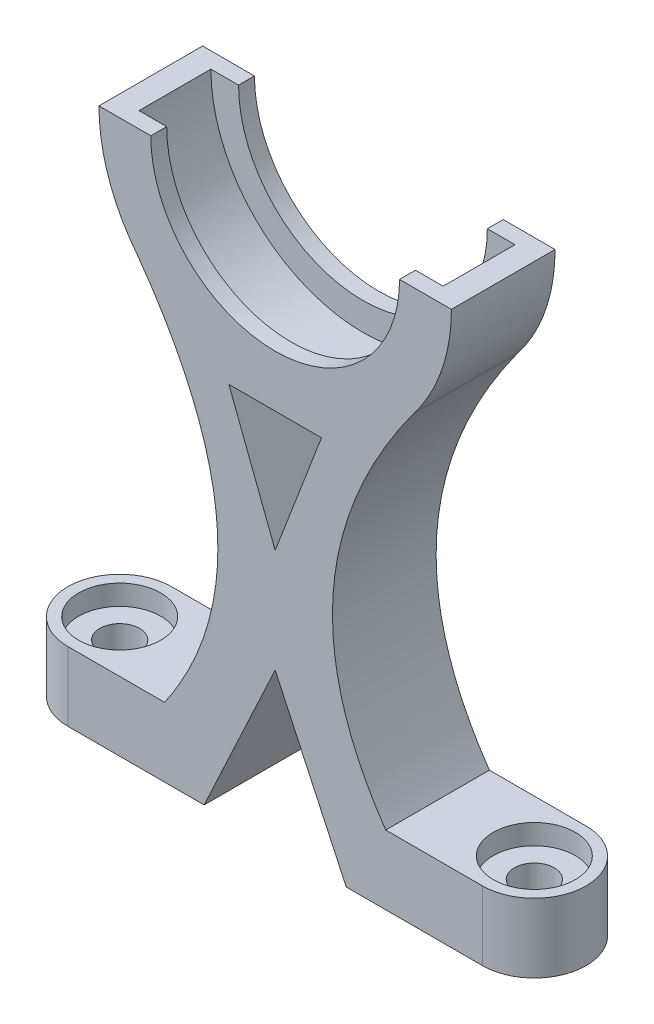
from build123d import *

# Parameters (mm, degrees)
BOSS_EXTRUDE1_DEPTH                            = 4.7625
SKETCH4_W                                      = 6.604
SKETCH4_H                                      = 2.54
BOSS_EXTRUDE2_DEPTH                            = 6.35
CBORE_FOR_6_BUTTON_HEAD_CAP_SCREW1_D           = 3.6576
CBORE_FOR_6_BUTTON_HEAD_CAP_SCREW1_DEPTH       = 6.35
CBORE_FOR_6_BUTTON_HEAD_CAP_SCREW1_CBORE_D     = 7.54126
CBORE_FOR_6_BUTTON_HEAD_CAP_SCREW1_CBORE_DEPTH = 1.8542


with BuildPart() as part:
    # Sketch1 → Boss-Extrude1 (new, symmetric)
    with BuildSketch(Plane.XY):
        with BuildLine():
            Line((6.52733268, -50.8), (0, -36.802089895))
            Line((0, -36.802089895), (-6.52733268, -50.8))
            Line((-6.52733268, -50.8), (-19.05, -50.8))
            Line((-19.05, -50.8), (-19.05, -44.45))
            Line((-19.05, -44.45), (-10.16, -44.45))
            add(Edge.make_bspline(
                [(-12.7, -10.045250432), (0.767706839, -28.651479816), (-10.16, -44.45)],
                knots=[0, 0, 0, 1, 1, 1], degree=2))
            ThreePointArc((-12.7, -10.045250432), (-15.29447296, -5.317532616), (-16.1925, 0))
            Line((-16.1925, 0), (-11.43, 0))
            ThreePointArc((-11.43, 0), (0, -11.43), (11.43, 0))
            Line((11.43, 0), (16.1925, 0))
            ThreePointArc((16.1925, 0), (15.29447296, -5.317532616), (12.7, -10.045250432))
            add(Edge.make_bspline(
                [(12.7, -10.045250432), (-0.767706839, -28.651479816), (10.16, -44.45)],
                knots=[0, 0, 0, 1, 1, 1], degree=2))
            Line((10.16, -44.45), (19.05, -44.45))
            Line((19.05, -44.45), (19.05, -50.8))
            Line((19.05, -50.8), (6.52733268, -50.8))
        make_face()
        Polygon((4.254975404, -16.1925), (-4.254975404, -16.1925), (0, -27.277089895), align=None, mode=Mode.SUBTRACT)
    extrude(amount=BOSS_EXTRUDE1_DEPTH, both=True)

    # Sketch4 → Cut-Revolve1 (revolve, cut)
    with BuildSketch(Plane(origin=(0, 0, 0), x_dir=(0, 0, -1), z_dir=(1, 0, 0))):
        with Locations((0, -12.7)):
            Rectangle(SKETCH4_W, SKETCH4_H)
    revolve(axis=Axis((0, 0, 0), (0, 0, -1)), mode=Mode.SUBTRACT)

    # Sketch8 → Boss-Extrude2 (add)
    with BuildSketch(Plane(origin=(0, -44.45, 0), x_dir=(1, 0, 0), z_dir=(0, 1, 0))):
        with BuildLine():
            Line((-19.05, 4.7625), (-19.05, -4.7625))
            ThreePointArc((-19.05, -4.7625), (-23.8125, 0), (-19.05, 4.7625))
        make_face()
        with BuildLine():
            Line((19.05, 4.7625), (19.05, -4.7625))
            ThreePointArc((19.05, -4.7625), (23.8125, 0), (19.05, 4.7625))
        make_face()
    extrude(amount=-BOSS_EXTRUDE2_DEPTH)

    # CBORE for #6 Button Head Cap Screw1
    with Locations(Plane(origin=(0, -44.45, 0), x_dir=(1, 0, 0), z_dir=(0, 1, 0))):
        with Locations((-19.05, 0), (19.05, 0)):
            CounterBoreHole(CBORE_FOR_6_BUTTON_HEAD_CAP_SCREW1_D / 2, CBORE_FOR_6_BUTTON_HEAD_CAP_SCREW1_CBORE_D / 2, CBORE_FOR_6_BUTTON_HEAD_CAP_SCREW1_CBORE_DEPTH, depth=CBORE_FOR_6_BUTTON_HEAD_CAP_SCREW1_DEPTH)


solid = part.part
